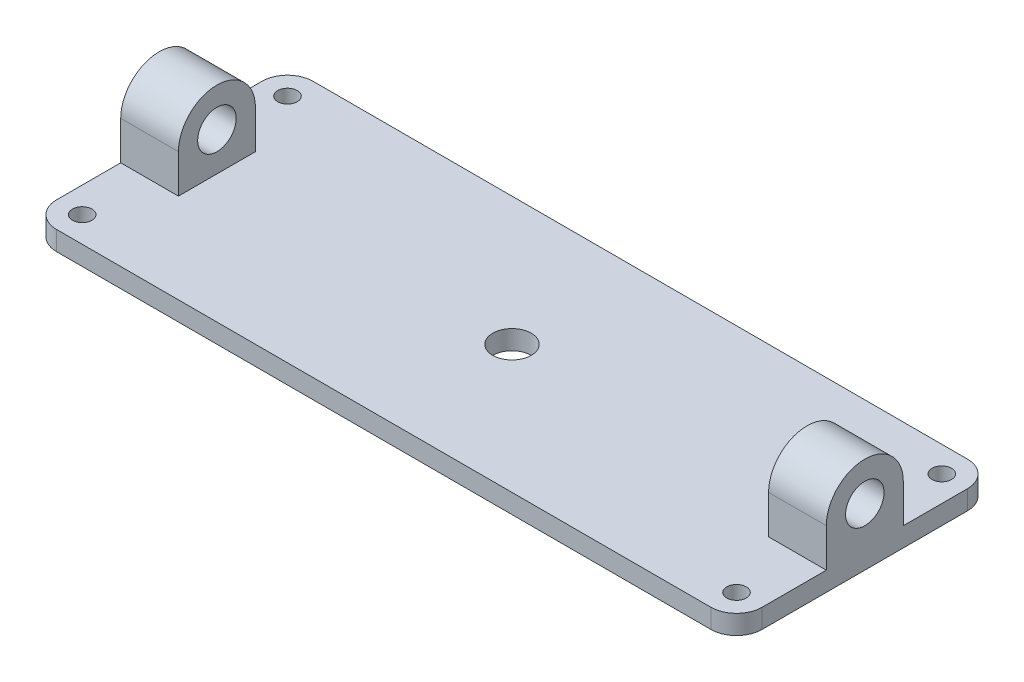
from build123d import *
from build123d.topology import SkipClean

# Parameters (mm, degrees)
SKETCH1_R           = 9.652
SKETCH1_R_2         = 19.05
BOSS_EXTRUDE1_DEPTH = 19.05
SKETCH1_3_W         = 57.15
SKETCH1_3_H         = 76.2
BOSS_EXTRUDE2_DEPTH = 57.15
BOSS_EXTRUDE3_DEPTH = 57.15
CUT_EXTRUDE2_DEPTH  = 57.15


with BuildPart() as part:
    # Sketch1 → Boss-Extrude1 (new body)
    with BuildSketch(Plane(origin=(0, 0, 0), x_dir=(1, 0, 0), z_dir=(0, 1, 0))):
        with BuildLine():
            ThreePointArc((-349.25, -101.6), (-341.810512242, -119.560512242), (-323.85, -127))
            Line((-323.85, -127), (323.85, -127))
            ThreePointArc((323.85, -127), (341.810512242, -119.560512242), (349.25, -101.6))
            Line((349.25, -101.6), (349.25, -38.1))
            Line((349.25, -38.1), (292.1, -38.1))
            Line((292.1, -38.1), (292.1, 38.1))
            Line((292.1, 38.1), (349.25, 38.1))
            Line((349.25, 38.1), (349.25, 101.6))
            ThreePointArc((349.25, 101.6), (341.810512242, 119.560512242), (323.85, 127))
            Line((323.85, 127), (-323.85, 127))
            ThreePointArc((-323.85, 127), (-341.810512242, 119.560512242), (-349.25, 101.6))
            Line((-349.25, 101.6), (-349.25, 38.1))
            Line((-349.25, 38.1), (-292.1, 38.1))
            Line((-292.1, 38.1), (-292.1, -38.1))
            Line((-292.1, -38.1), (-349.25, -38.1))
            Line((-349.25, -38.1), (-349.25, -101.6))
        make_face()
        with Locations((-323.85, -101.6)):
            Circle(SKETCH1_R, mode=Mode.SUBTRACT)
        with Locations((323.85, -101.6)):
            Circle(SKETCH1_R, mode=Mode.SUBTRACT)
        with Locations((-323.85, 101.6)):
            Circle(SKETCH1_R, mode=Mode.SUBTRACT)
        Circle(SKETCH1_R_2, mode=Mode.SUBTRACT)
        with Locations((323.85, 101.6)):
            Circle(SKETCH1_R, mode=Mode.SUBTRACT)
    extrude(amount=BOSS_EXTRUDE1_DEPTH)

    # Sketch1<3> → Boss-Extrude2 (add)
    with BuildSketch(Plane(origin=(0, 0, 0), x_dir=(1, 0, 0), z_dir=(0, 1, 0))):
        with Locations((-320.675, 0)):
            Rectangle(SKETCH1_3_W, SKETCH1_3_H)
        with Locations((320.675, 0)):
            Rectangle(SKETCH1_3_W, SKETCH1_3_H)
    extrude(amount=BOSS_EXTRUDE2_DEPTH)

    # Sketch2 → Boss-Extrude3 (add)
    with BuildSketch(Plane(origin=(349.25, 0, 0), x_dir=(0, 0, -1), z_dir=(1, 0, 0))):
        with BuildLine():
            Line((19.05, 57.15), (38.1, 57.15))
            ThreePointArc((38.1, 57.15), (0, 95.25), (-38.1, 57.15))
            Line((-38.1, 57.15), (-19.05, 57.15))
            ThreePointArc((-19.05, 57.15), (0, 76.2), (19.05, 57.15))
        make_face()
    boss_extrude3 = extrude(amount=-BOSS_EXTRUDE3_DEPTH)

    # Sketch2<4> → Cut-Extrude2 (cut)
    with SkipClean():  # the faces are left unmerged after this step: merging them gives an invalid solid
        with BuildSketch(Plane(origin=(349.25, 0, 0), x_dir=(0, 0, -1), z_dir=(1, 0, 0))):
            with BuildLine():
                ThreePointArc((-19.05, 57.15), (0, 38.1), (19.05, 57.15))
                Line((19.05, 57.15), (-19.05, 57.15))
            make_face()
        cut_extrude2 = extrude(amount=-CUT_EXTRUDE2_DEPTH, mode=Mode.SUBTRACT)
    add(part.part.scale(1), mode=Mode.REPLACE)  # the faces are merged on a copy

    # Mirror1: Boss-Extrude3, Cut-Extrude2 across plane
    with SkipClean():  # the faces are left unmerged after this step: merging them gives an invalid solid
        add(boss_extrude3.mirror(Plane(origin=(0, 0, 0), x_dir=(0, 0, 1), z_dir=(1, 0, 0))))
        add(cut_extrude2.mirror(Plane(origin=(0, 0, 0), x_dir=(0, 0, 1), z_dir=(1, 0, 0))), mode=Mode.SUBTRACT)


solid = part.part
